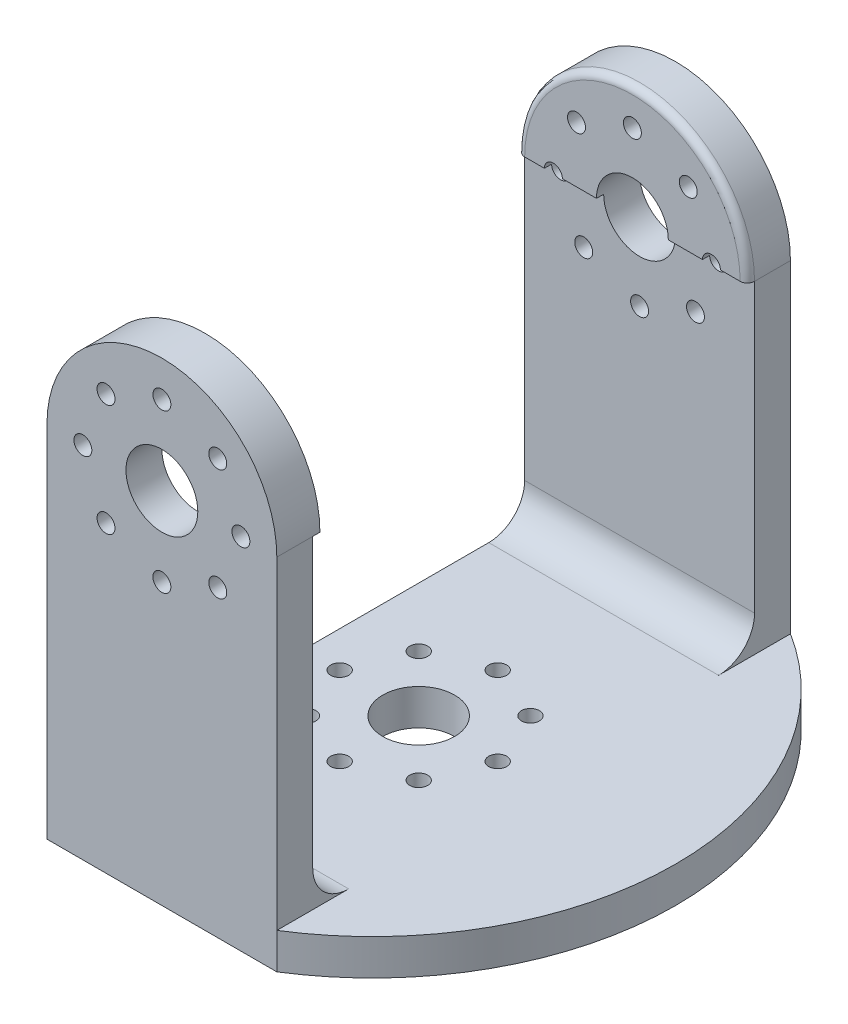
from build123d import *

# Parameters (mm, degrees)
SKETCH1_W           = 32
SKETCH1_H           = 71.5
BOSS_EXTRUDE1_DEPTH = 5
SKETCH2_W           = 32
SKETCH2_H           = 5
BOSS_EXTRUDE2_DEPTH = 45
BOSS_EXTRUDE3_DEPTH = 6
SKETCH4_R           = 5
SKETCH4_R_2         = 1.25
CUT_EXTRUDE1_DEPTH  = 99.796262783
SKETCH5_R           = 5
SKETCH5_R_2         = 1.25
CUT_EXTRUDE2_DEPTH  = 84.89844385
FILLET1_R           = 5
BOSS_EXTRUDE4_DEPTH = 5
FILLET2_R           = 1


with BuildPart() as part:
    # Sketch1 → Boss-Extrude1 (new body)
    with BuildSketch(Plane(origin=(0, 0, 0), x_dir=(1, 0, 0), z_dir=(0, 1, 0))):
        with Locations((-1.101214575, 13.142712551)):
            Rectangle(SKETCH1_W, SKETCH1_H)
    extrude(amount=BOSS_EXTRUDE1_DEPTH)

    # Sketch2 → Boss-Extrude2 (add)
    with BuildSketch(Plane(origin=(0, 5, 0), x_dir=(1, 0, 0), z_dir=(0, 1, 0))):
        with Locations((-1.101214575, -20.107287449)):
            Rectangle(SKETCH2_W, SKETCH2_H)
    boss_extrude2 = extrude(amount=BOSS_EXTRUDE2_DEPTH)

    # Mirror1: Boss-Extrude2 across plane
    add(boss_extrude2.mirror(Plane(origin=(0, 0, -13.142712551), x_dir=(1, 0, 0), z_dir=(0, 0, -1))))

    # Sketch3 → Boss-Extrude3 (add)
    with BuildSketch(Plane.XY.offset(22.607287449)):
        with BuildLine():
            Line((-17.101214575, 50), (14.898785425, 50))
            ThreePointArc((14.898785425, 50), (-1.101214575, 66), (-17.101214575, 50))
        make_face()
    boss_extrude3 = extrude(amount=-BOSS_EXTRUDE3_DEPTH)

    # Mirror3: Boss-Extrude3 across plane
    add(boss_extrude3.mirror(Plane(origin=(0, 0, -13.142712551), x_dir=(1, 0, 0), z_dir=(0, 0, -1))))

    # Sketch4 → Cut-Extrude1 (cut, through all)
    with BuildSketch(Plane.XY.offset(22.607287449)):
        with Locations((-1.101214575, 50)):
            Circle(SKETCH4_R)
        with Locations((-1.101214575, 61)):
            Circle(SKETCH4_R_2)
        with Locations((6.676960018, 57.778174593)):
            Circle(SKETCH4_R_2)
        with Locations((9.898785425, 50)):
            Circle(SKETCH4_R_2)
        with Locations((6.676960018, 42.221825407)):
            Circle(SKETCH4_R_2)
        with Locations((-1.101214575, 39)):
            Circle(SKETCH4_R_2)
        with Locations((-8.879389168, 42.221825407)):
            Circle(SKETCH4_R_2)
        with Locations((-12.101214575, 50)):
            Circle(SKETCH4_R_2)
        with Locations((-8.879389168, 57.778174593)):
            Circle(SKETCH4_R_2)
    extrude(amount=-CUT_EXTRUDE1_DEPTH, mode=Mode.SUBTRACT)

    # Sketch5 → Cut-Extrude2 (cut, through all)
    with BuildSketch(Plane(origin=(0, 0, 0), x_dir=(-1, 0, 0), z_dir=(0, -1, 0))):
        with Locations(Location((1.101214575, 13.142712551, 0), (0, 0, 90))):
            Circle(SKETCH5_R)
        with Locations(Location((1.101214575, 24.142712551, 0), (0, 0, 90))):
            Circle(SKETCH5_R_2)
        with Locations(Location((8.879389168, 20.920887144, 0), (0, 0, 90))):
            Circle(SKETCH5_R_2)
        with Locations(Location((12.101214575, 13.142712551, 0), (0, 0, 90))):
            Circle(SKETCH5_R_2)
        with Locations(Location((8.879389168, 5.364537958, 0), (0, 0, 90))):
            Circle(SKETCH5_R_2)
        with Locations(Location((1.101214575, 2.142712551, 0), (0, 0, 90))):
            Circle(SKETCH5_R_2)
        with Locations(Location((-6.676960018, 5.364537958, 0), (0, 0, 90))):
            Circle(SKETCH5_R_2)
        with Locations(Location((-9.898785425, 13.142712551, 0), (0, 0, 90))):
            Circle(SKETCH5_R_2)
        with Locations(Location((-6.676960018, 20.920887144, 0), (0, 0, 90))):
            Circle(SKETCH5_R_2)
    extrude(amount=-CUT_EXTRUDE2_DEPTH, mode=Mode.SUBTRACT)

    # Fillet1
    fillet1_edges = [part.edges().sort_by_distance(p)[0] for p in [
        (-1.101214575, 5, 17.607287449),
        (-1.101214575, 5, -43.892712551),
    ]]
    fillet(fillet1_edges, radius=FILLET1_R)

    # Sketch6 → Boss-Extrude4 (add)
    with BuildSketch(Plane.XZ):
        with BuildLine():
            Line((14.898785425, 22.607287449), (14.898785425, -48.892712551))
            ThreePointArc((14.898785425, -48.892712551), (34.663505701, -13.142712551), (14.898785425, 22.607287449))
        make_face()
    extrude(amount=-BOSS_EXTRUDE4_DEPTH)

    # Fillet2
    fillet2_edges = [part.edges().sort_by_distance(p)[0] for p in [
        (-1.101214575, 66, -42.892712551),
    ]]
    fillet(fillet2_edges, radius=FILLET2_R)


solid = part.part
